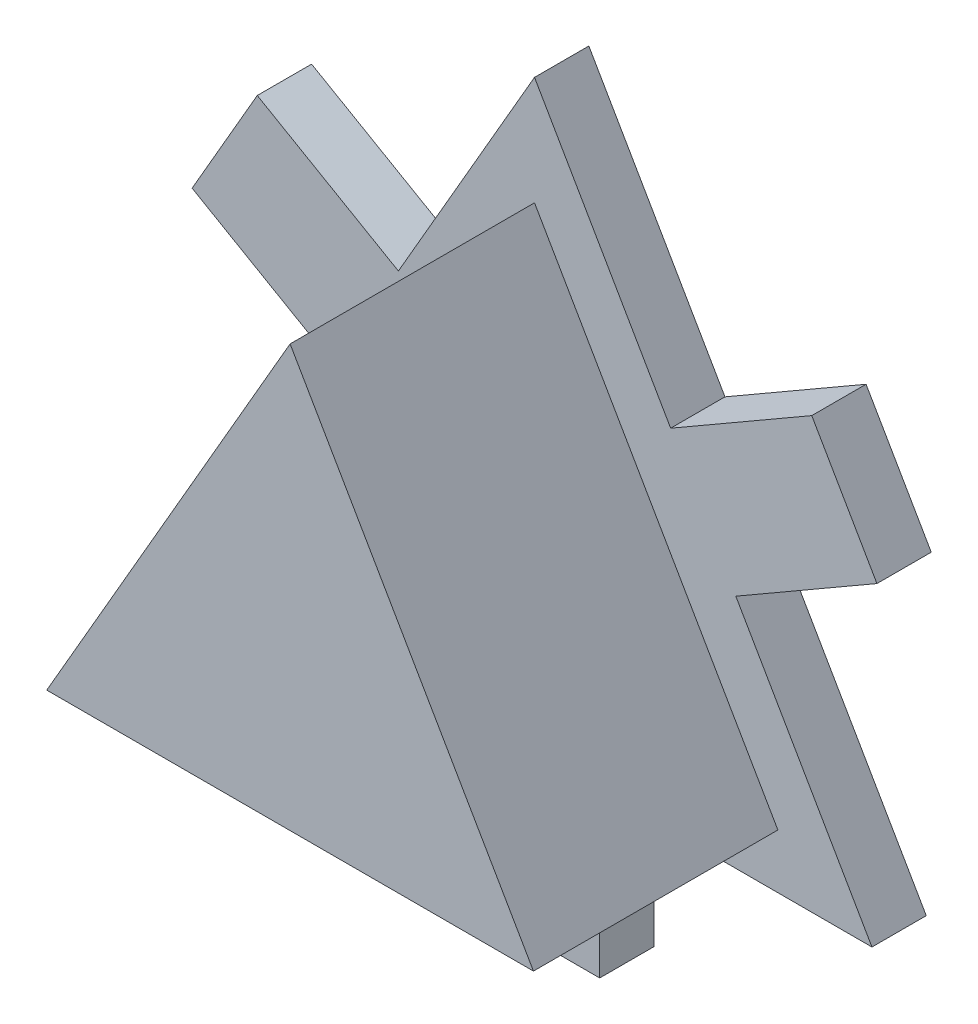
from build123d import *

# Parameters (mm, degrees)
BOSS_EXTRUDE1_DEPTH = 4.5
BOSS_EXTRUDE2_DEPTH = 1


with BuildPart() as part:
    # Sketch1 → Boss-Extrude1 (new body)
    with BuildSketch(Plane.XY):
        Polygon((4.032829212, -1.498375708), (12.993598728, -1.498375708), (8.51321397, 6.26187833), align=None)
    extrude(amount=BOSS_EXTRUDE1_DEPTH)

    # Sketch2 → Boss-Extrude2 (add)
    with BuildSketch(Plane(origin=(0, 0, 0), x_dir=(-1, 0, 0), z_dir=(0, 0, -1))):
        Polygon((-14.817507964, 3.342520827), (-12.219431753, 1.842520827), (-14.725649535, -2.498375708), (-9.71321397, -2.498375708), (-9.71321397, -5.498375708), (-7.31321397, -5.498375708), (-7.31321397, -2.498375708), (-2.300778405, -2.498375708), (-4.806996187, 1.842520827), (-2.208919976, 3.342520827), (-3.408919976, 5.420981796), (-6.006996187, 3.920981796), (-8.51321397, 8.26187833), (-11.019431753, 3.920981796), (-13.617507964, 5.420981796), align=None)
    extrude(amount=BOSS_EXTRUDE2_DEPTH)


solid = part.part
